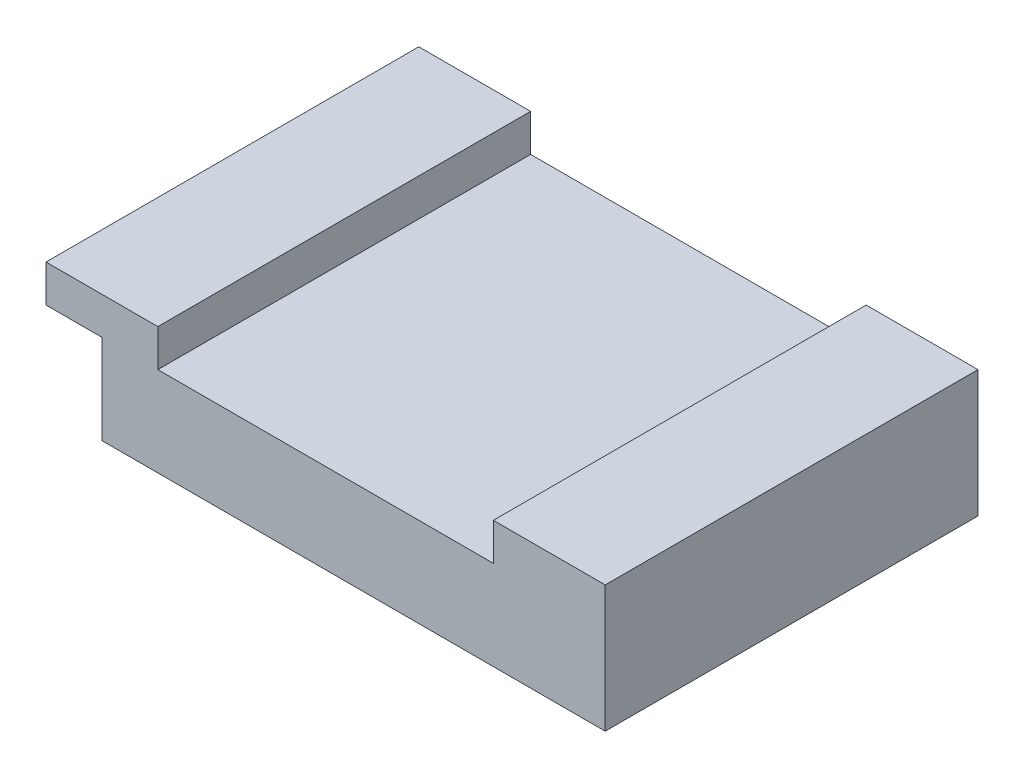
from build123d import *

# Parameters (mm, degrees)
SKETCH_1_W      = 15
SKETCH_1_H      = 5
EXTRUDE_1_DEPTH = 50
SKETCH_2_W      = 7.5
SKETCH_2_H      = 50
EXTRUDE_2_DEPTH = 12
SKETCH_3_W      = 50
SKETCH_3_H      = 12
EXTRUDE_3_DEPTH = 60
SKETCH_4_W      = 15
SKETCH_4_H      = 50
EXTRUDE_4_DEPTH = 5


with BuildPart() as part:
    # 스케치1 → 보스-돌출1 (new body)
    with BuildSketch(Plane.XY):
        with Locations((7.5, 2.5)):
            Rectangle(SKETCH_1_W, SKETCH_1_H)
    extrude(amount=EXTRUDE_1_DEPTH)

    # 스케치2 → 보스-돌출2 (add)
    with BuildSketch(Plane.XZ):
        with Locations((11.25, 25)):
            Rectangle(SKETCH_2_W, SKETCH_2_H)
    extrude(amount=EXTRUDE_2_DEPTH)

    # 스케치3 → 보스-돌출3 (add)
    with BuildSketch(Plane(origin=(15, 0, 0), x_dir=(0, 0, -1), z_dir=(1, 0, 0))):
        with Locations((-25, -6)):
            Rectangle(SKETCH_3_W, SKETCH_3_H)
    extrude(amount=EXTRUDE_3_DEPTH)

    # 스케치4 → 보스-돌출4 (add)
    with BuildSketch(Plane(origin=(0, 0, 0), x_dir=(1, 0, 0), z_dir=(0, 1, 0))):
        with Locations((67.5, -25)):
            Rectangle(SKETCH_4_W, SKETCH_4_H)
    extrude(amount=EXTRUDE_4_DEPTH)


solid = part.part
